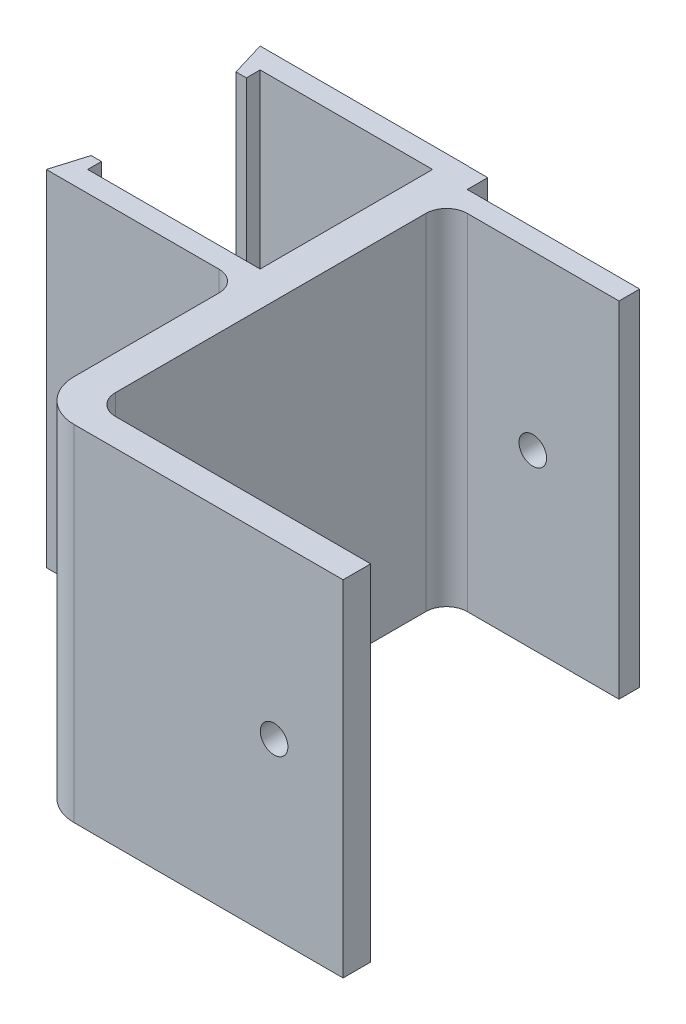
from build123d import *

# Parameters (mm, degrees)
EXTRUDE_1_DEPTH      = 110
CUT_EXTRUDE_4_DEPTH  = 134.373777696
SKETCH_7_W           = 16.60831278
SKETCH_7_H           = 38.473598513
CUT_EXTRUDE_14_DEPTH = 134.373777696
SKETCH_8_W           = 5
SKETCH_8_H           = 30.968526609
EXTRUDE_2_DEPTH      = 110
SKETCH_10_W          = 5
SKETCH_10_H          = 26
EXTRUDE_4_DEPTH      = 110
SKETCH_16_W          = 45
SKETCH_16_H          = 4
EXTRUDE_7_DEPTH      = 110
FILLET_4_R           = 3
FILLET_5_R           = 6
SKETCH_18_W          = 113.67218818
SKETCH_18_H          = 61.649849458
CUT_EXTRUDE_18_DEPTH = 137.586229955
SKETCH_19_R          = 2.1
SKETCH_19_R_2        = 2
CUT_EXTRUDE_19_DEPTH = 143.431323365
SKETCH_22_W          = 25
SKETCH_22_H          = 3
EXTRUDE_10_DEPTH     = 50
FILLET_7_R           = 3
SKETCH_23_R          = 2
CUT_EXTRUDE_24_DEPTH = 10


with BuildPart() as part:
    # Эскиз1 → Бобышка-Вытянуть1 (new body)
    with BuildSketch(Plane(origin=(0, 0, 0), x_dir=(1, 0, 0), z_dir=(0, 1, 0))):
        Polygon((-66.825757576, 34.969739794), (-66.825757576, 29.969739794), (-63.825757576, 29.969739794), (-63.825757576, 31.969739794), (-38.825757576, 31.969739794), (-38.825757576, 6.969739794), (-63.825757576, 6.969739794), (-63.825757576, 8.969739794), (-66.825757576, 8.969739794), (-66.825757576, 3.969739794), (-22.123470102, 3.969739794), (-36.579007505, 34.969739794), align=None)
    extrude(amount=EXTRUDE_1_DEPTH)

    # Эскиз3 → Вырез-Вытянуть4 (cut, through all)
    with BuildSketch(Plane.XZ):
        Polygon((-66.825757576, -3.969739794), (-65.325757576, -8.969739794), (-66.825757576, -8.969739794), align=None)
        Polygon((-66.825757576, -29.969739794), (-66.825757576, -34.969739794), (-65.325757576, -29.969739794), align=None)
    extrude(amount=-CUT_EXTRUDE_4_DEPTH, mode=Mode.SUBTRACT)

    # Эскиз7 → Вырез-Вытянуть14 (cut, through all)
    with BuildSketch(Plane(origin=(0, 0, 0), x_dir=(-1, 0, 0), z_dir=(0, -1, 0))):
        with Locations((27.703474463, 20.539743139)):
            Rectangle(SKETCH_7_W, SKETCH_7_H)
    extrude(amount=-CUT_EXTRUDE_14_DEPTH, mode=Mode.SUBTRACT)

    # Эскиз8 → Бобышка-Вытянуть2 (add)
    with BuildSketch(Plane(origin=(0, 0, 0), x_dir=(-1, 0, 0), z_dir=(0, -1, 0))):
        with Locations((36.298943925, 19.454003098)):
            Rectangle(SKETCH_8_W, SKETCH_8_H)
    extrude(amount=-EXTRUDE_2_DEPTH)

    # Эскиз10 → Бобышка-Вытянуть4 (add)
    with BuildSketch(Plane.XZ):
        with Locations((-36.298943925, 9.030260206)):
            Rectangle(SKETCH_10_W, SKETCH_10_H)
    extrude(amount=-EXTRUDE_4_DEPTH)

    # Эскиз16 → Бобышка-Вытянуть7 (add, through all)
    with BuildSketch(Plane(origin=(0, 110, 0), x_dir=(1, 0, 0), z_dir=(0, 1, 0))):
        with Locations((-16.298943925, -24.030260206)):
            Rectangle(SKETCH_16_W, SKETCH_16_H)
    extrude(amount=-EXTRUDE_7_DEPTH)

    # Скругление4
    fillet_4_edges = [part.edges().sort_by_distance(p)[0] for p in [
        (-38.798943925, 55, -3.969739794),
        (-33.798943925, 55, 22.030260206),
    ]]
    fillet(fillet_4_edges, radius=FILLET_4_R)

    # Скругление5
    fillet_5_edges = [part.edges().sort_by_distance(p)[0] for p in [
        (-38.798943925, 55, 26.030260206),
    ]]
    fillet(fillet_5_edges, radius=FILLET_5_R)

    # Эскиз18 → Вырез-Вытянуть18 (cut, through all)
    with BuildSketch(Plane(origin=(6.201056075, 0, 0), x_dir=(0, 0, -1), z_dir=(1, 0, 0))):
        with Locations((3.709673157, 29.175075271)):
            Rectangle(SKETCH_18_W, SKETCH_18_H)
    extrude(amount=-CUT_EXTRUDE_18_DEPTH, mode=Mode.SUBTRACT)

    # Эскиз19 → Вырез-Вытянуть19 (cut, through all)
    with BuildSketch(Plane(origin=(0, 0, -34.969739794), x_dir=(-1, 0, 0), z_dir=(0, 0, -1))):
        with Locations((51.70238254, 85)):
            Circle(SKETCH_19_R)
        with Locations((3.798943925, 85)):
            Circle(SKETCH_19_R_2)
    extrude(amount=-CUT_EXTRUDE_19_DEPTH, mode=Mode.SUBTRACT)

    # Эскиз22 → Бобышка-Вытянуть10 (add)
    with BuildSketch(Plane.XZ.offset(-60)):
        with Locations((-21.298943925, -30.469739794)):
            Rectangle(SKETCH_22_W, SKETCH_22_H)
    extrude(amount=-EXTRUDE_10_DEPTH)

    # Скругление7
    fillet_7_edges = [part.edges().sort_by_distance(p)[0] for p in [
        (-33.798943925, 85, -28.969739794),
    ]]
    fillet(fillet_7_edges, radius=FILLET_7_R)

    # Эскиз23 → Вырез-Вытянуть24 (cut)
    with BuildSketch(Plane(origin=(0, 0, -31.969739794), x_dir=(-1, 0, 0), z_dir=(0, 0, -1))):
        with Locations((21.298943925, 85)):
            Circle(SKETCH_23_R)
    extrude(amount=-CUT_EXTRUDE_24_DEPTH, mode=Mode.SUBTRACT)


solid = part.part
